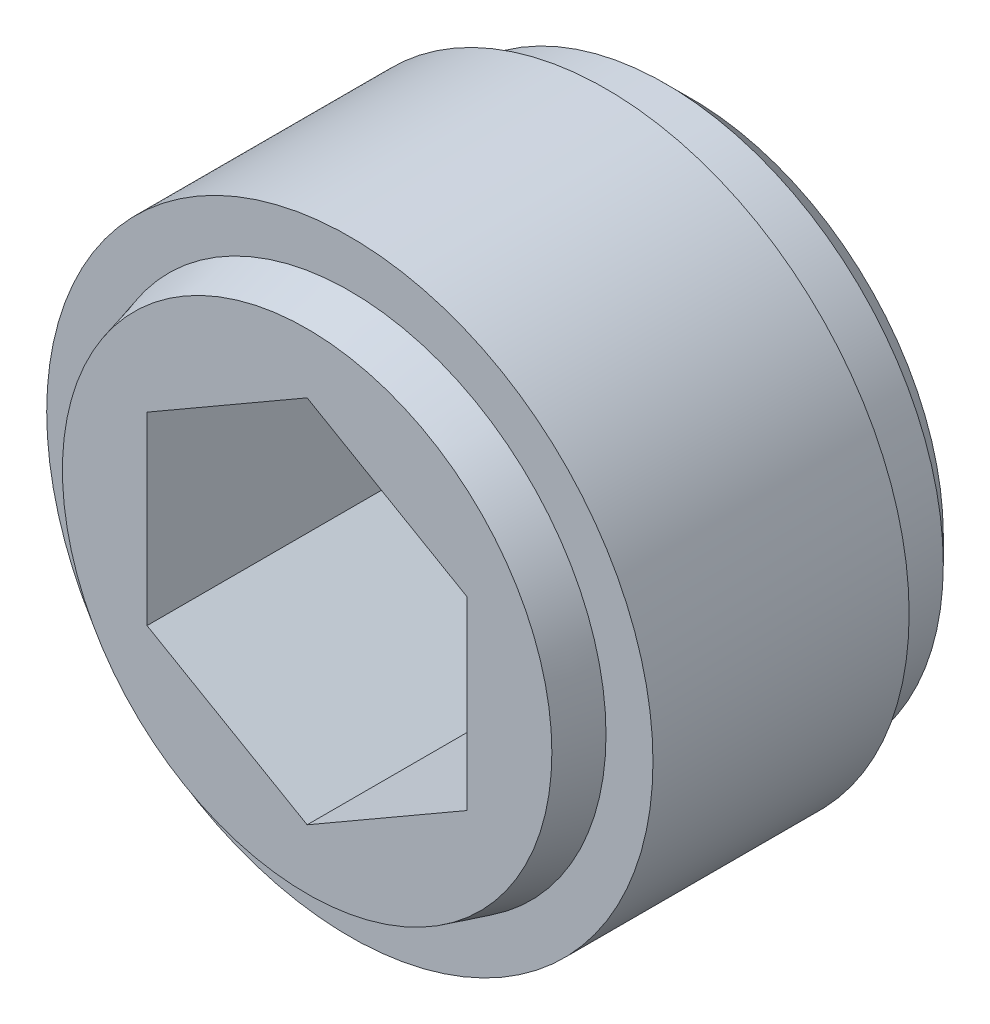
from build123d import *

# Parameters (mm, degrees)
SKETCH1_R           = 4.5085
BOSS_EXTRUDE1_DEPTH = 5.08
SKETCH2_R           = 3.81
BOSS_EXTRUDE2_DEPTH = 0.635
BOSS_EXTRUDE2_TAPER = 15
SKETCH3_R           = 4.5085
SKETCH3_R_2         = 4.1275
CUT_EXTRUDE1_DEPTH  = 1.27
CHAMFER1_SIZE       = 0.381
CUT_EXTRUDE2_DEPTH  = 9.562381065


with BuildPart() as part:
    # Sketch1 → Boss-Extrude1 (new body)
    with BuildSketch(Plane.XY):
        Circle(SKETCH1_R)
    extrude(amount=BOSS_EXTRUDE1_DEPTH)

    # Sketch2 → Boss-Extrude2 (add)
    with BuildSketch(Plane.XY.offset(5.08)):
        Circle(SKETCH2_R)
    extrude(amount=BOSS_EXTRUDE2_DEPTH, taper=BOSS_EXTRUDE2_TAPER)

    # Sketch3 → Cut-Extrude1 (cut)
    with BuildSketch(Plane(origin=(0, 0, 0), x_dir=(-1, 0, 0), z_dir=(0, 0, -1))):
        Circle(SKETCH3_R)
        Circle(SKETCH3_R_2, mode=Mode.SUBTRACT)
    extrude(amount=-CUT_EXTRUDE1_DEPTH, mode=Mode.SUBTRACT)

    # Chamfer1
    chamfer1_edges = [part.edges().sort_by_distance(p)[0] for p in [
        (4.1275, 0, 0),
    ]]
    chamfer(chamfer1_edges, length=CHAMFER1_SIZE)

    # Sketch4 → Cut-Extrude2 (cut, through all)
    with BuildSketch(Plane(origin=(0, 0, 0), x_dir=(-1, 0, 0), z_dir=(0, 0, -1))):
        Polygon((0, 2.749630657), (-2.38125, 1.374815329), (-2.38125, -1.374815329), (0, -2.749630657), (2.38125, -1.374815329), (2.38125, 1.374815329), align=None)
    extrude(amount=-CUT_EXTRUDE2_DEPTH, mode=Mode.SUBTRACT)


solid = part.part
